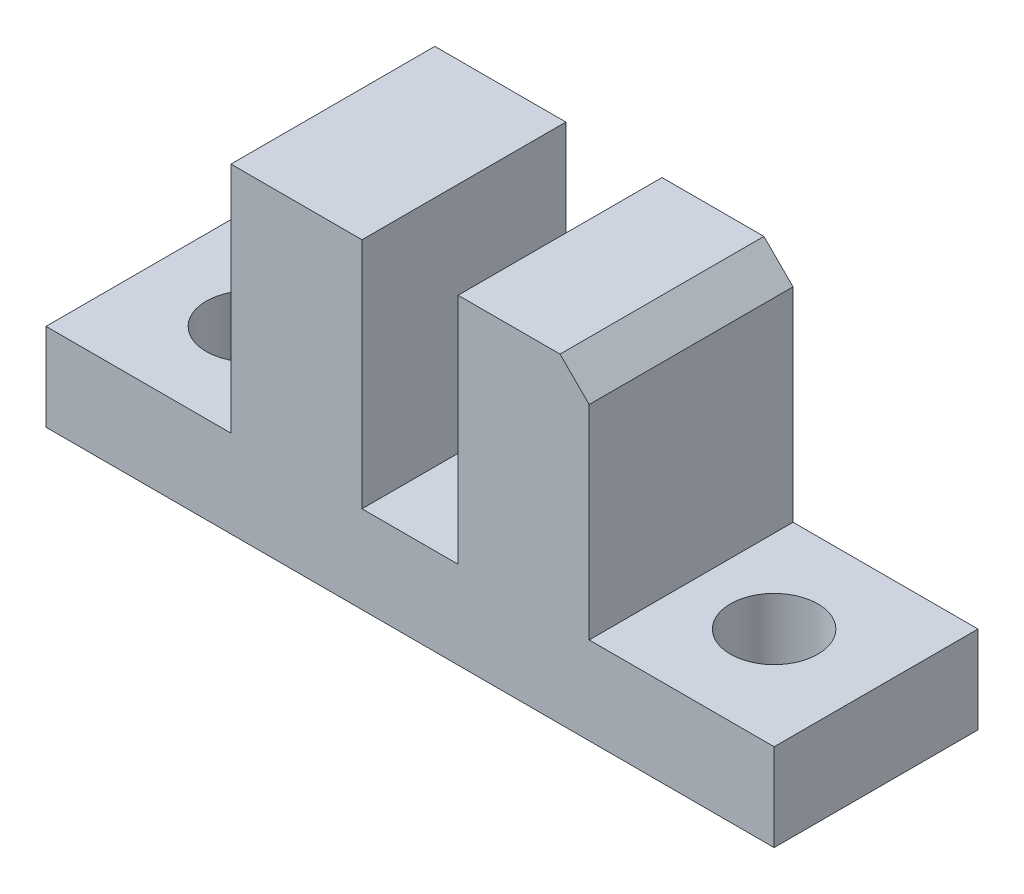
from build123d import *

# Parameters (mm, degrees)
SKETCH1_W           = 25
SKETCH1_H           = 7
SKETCH1_R           = 1.5
BOSS_EXTRUDE1_DEPTH = 3
SKETCH2_W           = 4.5
SKETCH2_H           = 7
BOSS_EXTRUDE2_DEPTH = 11
CHAMFER1_SIZE       = 1


with BuildPart() as part:
    # Sketch1 → Boss-Extrude1 (new body)
    with BuildSketch(Plane(origin=(0, 0, 0), x_dir=(1, 0, 0), z_dir=(0, 1, 0))):
        Rectangle(SKETCH1_W, SKETCH1_H)
        with Locations(Location((9, 0, 0), (0, 0, 270))):
            Circle(SKETCH1_R, mode=Mode.SUBTRACT)
        with Locations(Location((-9, 0, 0), (0, 0, 90))):
            Circle(SKETCH1_R, mode=Mode.SUBTRACT)
    extrude(amount=BOSS_EXTRUDE1_DEPTH)

    # Sketch2 → Boss-Extrude2 (add)
    with BuildSketch(Plane.XZ):
        with Locations((-3.9, 0)):
            Rectangle(SKETCH2_W, SKETCH2_H)
        with Locations((3.9, 0)):
            Rectangle(SKETCH2_W, SKETCH2_H)
    extrude(amount=-BOSS_EXTRUDE2_DEPTH)

    # Chamfer1
    chamfer1_edges = [part.edges().sort_by_distance(p)[0] for p in [
        (6.15, 11, 0),
    ]]
    chamfer(chamfer1_edges, length=CHAMFER1_SIZE)


solid = part.part
